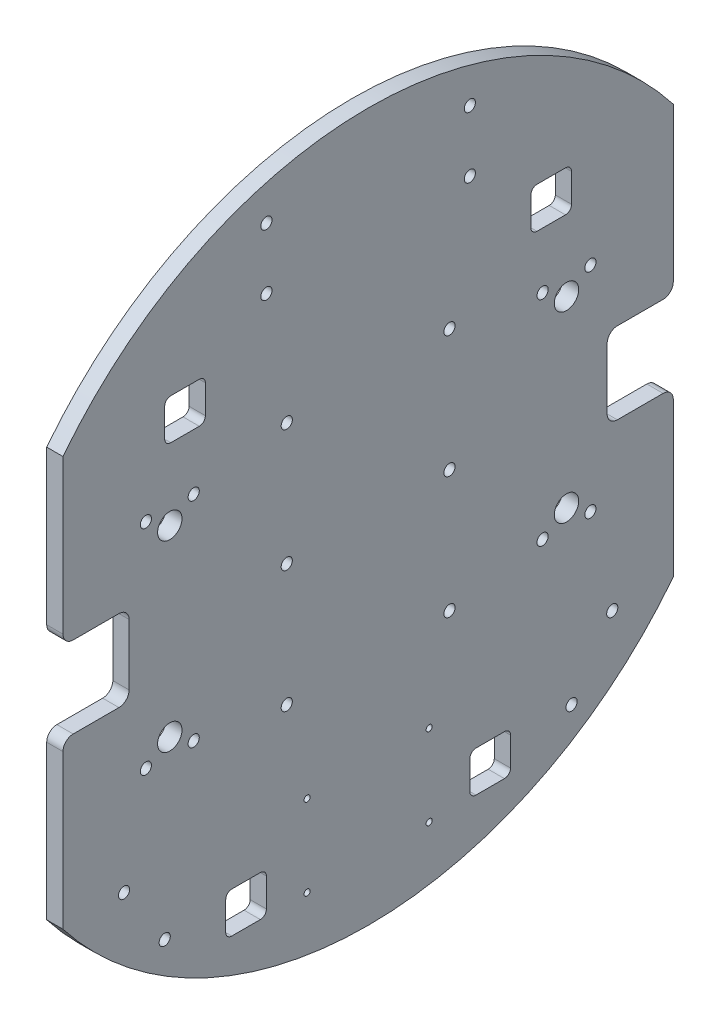
from build123d import *

# Parameters (mm, degrees)
EXTRUDE_1_DEPTH     = 8
SKETCH_2_R          = 6
SKETCH_2_R_2        = 2.75
CUT_EXTRUDE_1_DEPTH = 8
SKETCH_3_R          = 2.75
CUT_EXTRUDE_2_DEPTH = 10
SKETCH_4_W          = 32.5
SKETCH_4_H          = 40
CUT_EXTRUDE_3_DEPTH = 10
FILLET_1_R          = 5
SKETCH_5_R          = 2.75
CUT_EXTRUDE_4_DEPTH = 230.869528211
SKETCH_6_W          = 20
SKETCH_6_H          = 20
CUT_EXTRUDE_5_DEPTH = 230.869528211
FILLET_2_R          = 3
SKETCH_7_R          = 1.5
SKETCH_7_R_2        = 2.75
CUT_EXTRUDE_6_DEPTH = 230.869528211
SKETCH_8_W          = 20
SKETCH_8_H          = 20
CUT_EXTRUDE_7_DEPTH = 230.869528211
FILLET_3_R          = 3


with BuildPart() as part:
    # 草图1 → 凸台-拉伸1 (new body)
    with BuildSketch(Plane(origin=(0, 0, 0), x_dir=(0, 0, -1), z_dir=(1, 0, 0))):
        with BuildLine():
            Line((-150, 100.619037897), (-150, -100.619037897))
            ThreePointArc((-150, -100.619037897), (0, -174), (150, -100.619037897))
            Line((150, -100.619037897), (150, 100.619037897))
            ThreePointArc((150, 100.619037897), (0, 174), (-150, 100.619037897))
        make_face()
    extrude(amount=EXTRUDE_1_DEPTH)

    # 草图2 → 切除-拉伸1 (cut)
    with BuildSketch(Plane(origin=(8, 0, 0), x_dir=(0, 0, -1), z_dir=(1, 0, 0))):
        with Locations((97.5, 45)):
            Circle(SKETCH_2_R)
        with Locations((97.5, -45)):
            Circle(SKETCH_2_R)
        with Locations((85.75, 52.5)):
            Circle(SKETCH_2_R_2)
        with Locations((109.25, 52.5)):
            Circle(SKETCH_2_R_2)
        with Locations((85.75, -52.5)):
            Circle(SKETCH_2_R_2)
        with Locations((109.25, -52.5)):
            Circle(SKETCH_2_R_2)
        with Locations(Location((-109.25, -52.5, 0), (0, 0, 180))):
            Circle(SKETCH_2_R_2)
        with Locations(Location((-85.75, -52.5, 0), (0, 0, 180))):
            Circle(SKETCH_2_R_2)
        with Locations(Location((-109.25, 52.5, 0), (0, 0, 180))):
            Circle(SKETCH_2_R_2)
        with Locations(Location((-85.75, 52.5, 0), (0, 0, 180))):
            Circle(SKETCH_2_R_2)
        with Locations(Location((-97.5, -45, 0), (0, 0, 180))):
            Circle(SKETCH_2_R)
        with Locations(Location((-97.5, 45, 0), (0, 0, 180))):
            Circle(SKETCH_2_R)
    extrude(amount=-CUT_EXTRUDE_1_DEPTH, mode=Mode.SUBTRACT)

    # 草图3 → 切除-拉伸2 (cut)
    with BuildSketch(Plane(origin=(8, 0, 0), x_dir=(0, 0, -1), z_dir=(1, 0, 0))):
        with Locations((-40, 60)):
            Circle(SKETCH_3_R)
        with Locations((40, 60)):
            Circle(SKETCH_3_R)
        with Locations((40, -60)):
            Circle(SKETCH_3_R)
        with Locations((-40, -60)):
            Circle(SKETCH_3_R)
        with Locations((40, 0)):
            Circle(SKETCH_3_R)
        with Locations((-40, 0)):
            Circle(SKETCH_3_R)
    extrude(amount=-CUT_EXTRUDE_2_DEPTH, mode=Mode.SUBTRACT)

    # 草图4 → 切除-拉伸3 (cut)
    with BuildSketch(Plane(origin=(8, 0, 0), x_dir=(0, 0, -1), z_dir=(1, 0, 0))):
        with Locations((133.75, 0)):
            Rectangle(SKETCH_4_W, SKETCH_4_H)
        with Locations((-133.75, 0)):
            Rectangle(SKETCH_4_W, SKETCH_4_H)
    extrude(amount=-CUT_EXTRUDE_3_DEPTH, mode=Mode.SUBTRACT)

    # 圆角1
    fillet_1_edges = [part.edges().sort_by_distance(p)[0] for p in [
        (4, -20, -117.5),
        (4, 20, -117.5),
        (4, 20, -150),
        (4, -20, -150),
        (4, 20, 150),
        (4, 20, 117.5),
        (4, -20, 117.5),
        (4, -20, 150),
    ]]
    fillet(fillet_1_edges, radius=FILLET_1_R)

    # 草图5 → 切除-拉伸4 (cut, through all)
    with BuildSketch(Plane(origin=(8, 0, 0), x_dir=(0, 0, -1), z_dir=(1, 0, 0))):
        with Locations((50, 150)):
            Circle(SKETCH_5_R)
        with Locations((-50, 150)):
            Circle(SKETCH_5_R)
        with Locations((-50, 120)):
            Circle(SKETCH_5_R)
        with Locations((50, 120)):
            Circle(SKETCH_5_R)
    extrude(amount=-CUT_EXTRUDE_4_DEPTH, mode=Mode.SUBTRACT)

    # 草图6 → 切除-拉伸5 (cut, through all)
    with BuildSketch(Plane(origin=(8, 0, 0), x_dir=(0, 0, -1), z_dir=(1, 0, 0))):
        with Locations((-90, 90)):
            Rectangle(SKETCH_6_W, SKETCH_6_H)
        with Locations((90, 90)):
            Rectangle(SKETCH_6_W, SKETCH_6_H)
    extrude(amount=-CUT_EXTRUDE_5_DEPTH, mode=Mode.SUBTRACT)

    # 圆角2
    fillet_2_edges = [part.edges().sort_by_distance(p)[0] for p in [
        (4, 80, 100),
        (4, 100, 100),
        (4, 100, 80),
        (4, 80, 80),
        (4, 100, -80),
        (4, 100, -100),
        (4, 80, -100),
        (4, 80, -80),
    ]]
    fillet(fillet_2_edges, radius=FILLET_2_R)

    # 草图7 → 切除-拉伸6 (cut, through all)
    with BuildSketch(Plane(origin=(8, 0, 0), x_dir=(0, 0, -1), z_dir=(1, 0, 0))):
        with Locations((-30, -105)):
            Circle(SKETCH_7_R)
        with Locations((-30, -145)):
            Circle(SKETCH_7_R)
        with Locations((30, -145)):
            Circle(SKETCH_7_R)
        with Locations((30, -105)):
            Circle(SKETCH_7_R)
        with Locations((120, -100)):
            Circle(SKETCH_7_R_2)
        with Locations((100, -130)):
            Circle(SKETCH_7_R_2)
        with Locations(Location((-100, -130, 0), (0, 0, 180))):
            Circle(SKETCH_7_R_2)
        with Locations(Location((-120, -100, 0), (0, 0, 180))):
            Circle(SKETCH_7_R_2)
    extrude(amount=-CUT_EXTRUDE_6_DEPTH, mode=Mode.SUBTRACT)

    # 草图8 → 切除-拉伸7 (cut, through all)
    with BuildSketch(Plane(origin=(8, 0, 0), x_dir=(0, 0, -1), z_dir=(1, 0, 0))):
        with Locations((60, -135)):
            Rectangle(SKETCH_8_W, SKETCH_8_H)
        with Locations((-60, -135)):
            Rectangle(SKETCH_8_W, SKETCH_8_H)
    extrude(amount=-CUT_EXTRUDE_7_DEPTH, mode=Mode.SUBTRACT)

    # 圆角3
    fillet_3_edges = [part.edges().sort_by_distance(p)[0] for p in [
        (4, -145, -50),
        (4, -125, -50),
        (4, -125, -70),
        (4, -145, -70),
        (4, -125, 70),
        (4, -125, 50),
        (4, -145, 50),
        (4, -145, 70),
    ]]
    fillet(fillet_3_edges, radius=FILLET_3_R)


solid = part.part
